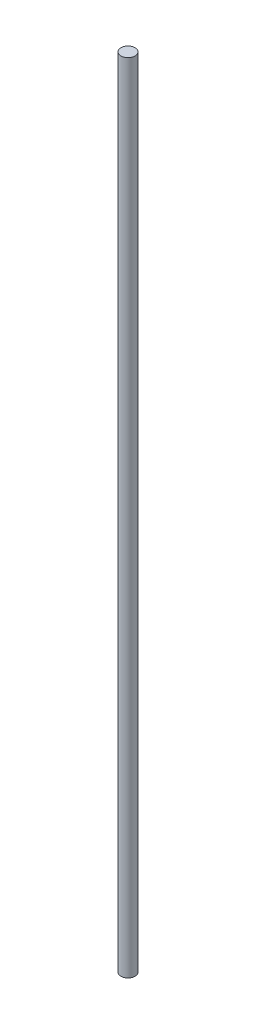
from build123d import *

# Parameters (mm, degrees)
SKETCH_2_R      = 5
EXTRUDE_1_DEPTH = 560


with BuildPart() as part:
    # 草图2 → 凸台-拉伸1 (new body)
    with BuildSketch(Plane(origin=(0, 0, 0), x_dir=(1, 0, 0), z_dir=(0, 1, 0))):
        with Locations(Location((0, 0, 0), (0, 0, 270))):
            Circle(SKETCH_2_R)
    extrude(amount=EXTRUDE_1_DEPTH)


solid = part.part
